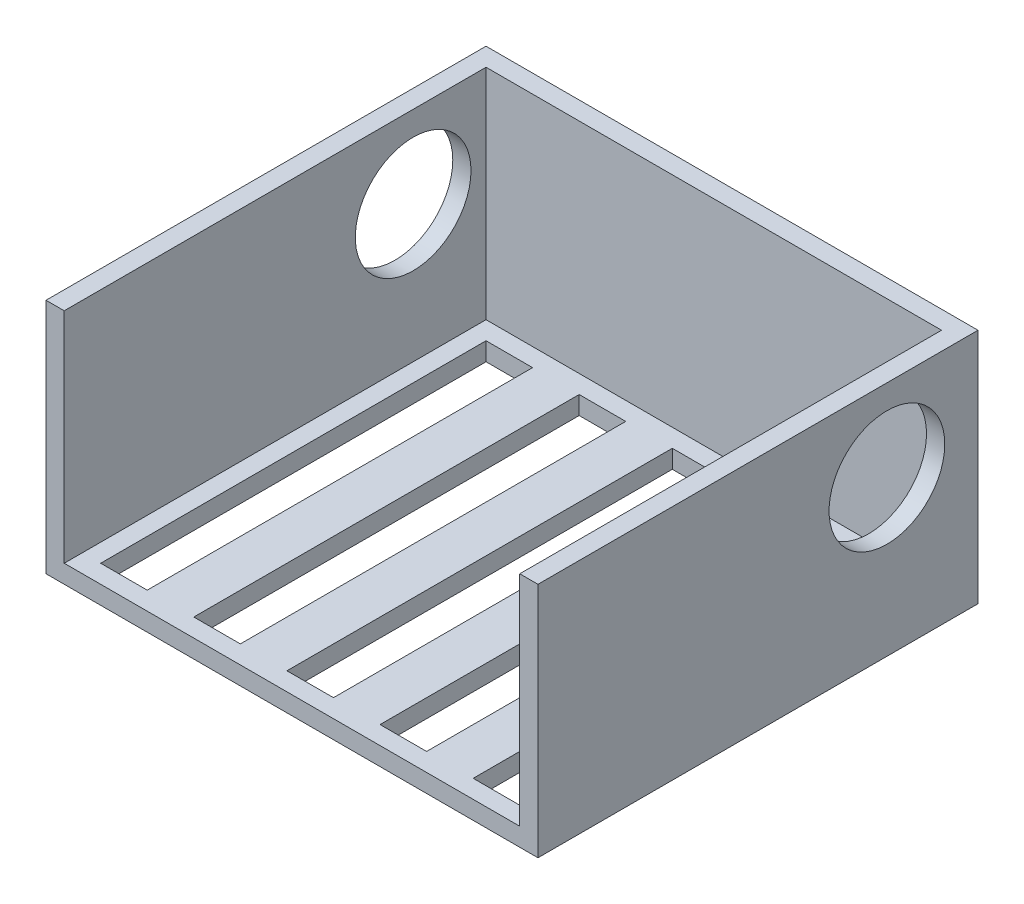
from build123d import *

# Parameters (mm, degrees)
CROQUIS1_W                 = 54
CROQUIS1_H                 = 50.3
CROQUIS1_W_2               = 50
CROQUIS1_H_2               = 46.3
SALIENTE_EXTRUIR1_DEPTH    = 24
CROQUIS2_W                 = 54
CROQUIS2_H                 = 50.3
SALIENTE_EXTRUIR2_DEPTH    = 2
CORTAR_EXTRUIR4_DEPTH      = 54
CORTAR_EXTRUIR5_REACH      = 75.646
CROQUIS7_W                 = 5.111111111
CROQUIS7_H                 = 42.3
CROQUIS7_W_2               = 5.111111112
CORTAR_EXTRUIR6_DEPTH      = 59.725548103
CORTAR_EXTRUIR6_DEPTH_BACK = 59.725548103
CROQUIS8_R                 = 6.35


with BuildPart() as part:
    # Croquis1 → Saliente-Extruir1 (new body)
    with BuildSketch(Plane(origin=(0, 0, 0), x_dir=(1, 0, 0), z_dir=(0, 1, 0))):
        with Locations((-25, -23.15)):
            Rectangle(CROQUIS1_W, CROQUIS1_H)
        with Locations((-25, -23.15)):
            Rectangle(CROQUIS1_W_2, CROQUIS1_H_2, mode=Mode.SUBTRACT)
    extrude(amount=SALIENTE_EXTRUIR1_DEPTH)

    # Croquis2 → Saliente-Extruir2 (add)
    with BuildSketch(Plane.XZ):
        with Locations((-25, 23.15)):
            Rectangle(CROQUIS2_W, CROQUIS2_H)
    extrude(amount=SALIENTE_EXTRUIR2_DEPTH)

    # Croquis6 → Cortar-Extruir4 (cut)
    with BuildSketch(Plane.ZY.offset(52)):
        Polygon((46.3, 24), (46.3, 0), (46.3, -2), (48.3, -2), (48.3, 24), align=None)
    extrude(amount=-CORTAR_EXTRUIR4_DEPTH, mode=Mode.SUBTRACT)

    # Croquis7 → Cortar-Extruir5 (cut, up to next)
    with BuildSketch(Plane(origin=(0, 0, 0), x_dir=(1, 0, 0), z_dir=(0, 1, 0)), mode=Mode.PRIVATE) as cortar_extruir5_sk1:
        with Locations((-45.444444445, -23.15)):
            Rectangle(CROQUIS7_W, CROQUIS7_H)
    cortar_extruir5_tool1 = extrude(cortar_extruir5_sk1.sketch, amount=-CORTAR_EXTRUIR5_REACH, mode=Mode.PRIVATE) & part.part
    # Croquis7 → Cortar-Extruir5 (cut, up to next)
    with BuildSketch(Plane(origin=(0, 0, 0), x_dir=(1, 0, 0), z_dir=(0, 1, 0)), mode=Mode.PRIVATE) as cortar_extruir5_sk2:
        with Locations((-35.222222223, -23.15)):
            Rectangle(CROQUIS7_W, CROQUIS7_H)
    cortar_extruir5_tool2 = extrude(cortar_extruir5_sk2.sketch, amount=-CORTAR_EXTRUIR5_REACH, mode=Mode.PRIVATE) & part.part
    # Croquis7 → Cortar-Extruir5 (cut, up to next)
    with BuildSketch(Plane(origin=(0, 0, 0), x_dir=(1, 0, 0), z_dir=(0, 1, 0)), mode=Mode.PRIVATE) as cortar_extruir5_sk3:
        with Locations((-14.777777778, -23.15)):
            Rectangle(CROQUIS7_W, CROQUIS7_H)
    cortar_extruir5_tool3 = extrude(cortar_extruir5_sk3.sketch, amount=-CORTAR_EXTRUIR5_REACH, mode=Mode.PRIVATE) & part.part
    # Croquis7 → Cortar-Extruir5 (cut, up to next)
    with BuildSketch(Plane(origin=(0, 0, 0), x_dir=(1, 0, 0), z_dir=(0, 1, 0)), mode=Mode.PRIVATE) as cortar_extruir5_sk4:
        with Locations((-4.555555555, -23.15)):
            Rectangle(CROQUIS7_W, CROQUIS7_H)
    cortar_extruir5_tool4 = extrude(cortar_extruir5_sk4.sketch, amount=-CORTAR_EXTRUIR5_REACH, mode=Mode.PRIVATE) & part.part
    # Croquis7 → Cortar-Extruir5 (cut, up to next)
    with BuildSketch(Plane(origin=(0, 0, 0), x_dir=(1, 0, 0), z_dir=(0, 1, 0)), mode=Mode.PRIVATE) as cortar_extruir5_sk5:
        with Locations((-25, -23.15)):
            Rectangle(CROQUIS7_W_2, CROQUIS7_H)
    cortar_extruir5_tool5 = extrude(cortar_extruir5_sk5.sketch, amount=-CORTAR_EXTRUIR5_REACH, mode=Mode.PRIVATE) & part.part
    add(cortar_extruir5_tool1.solids().sort_by_distance((-45.444444, 0, 23.15))[0], mode=Mode.SUBTRACT)
    add(cortar_extruir5_tool2.solids().sort_by_distance((-35.222222, 0, 23.15))[0], mode=Mode.SUBTRACT)
    add(cortar_extruir5_tool3.solids().sort_by_distance((-14.777778, 0, 23.15))[0], mode=Mode.SUBTRACT)
    add(cortar_extruir5_tool4.solids().sort_by_distance((-4.555556, 0, 23.15))[0], mode=Mode.SUBTRACT)
    add(cortar_extruir5_tool5.solids().sort_by_distance((-25, 0, 23.15))[0], mode=Mode.SUBTRACT)

    # Croquis8 → Cortar-Extruir6 (cut, two sides: drawn at the far end of the back side and taken through both)
    with BuildSketch(Plane(origin=(-25, 0, 0), x_dir=(0, 0, -1), z_dir=(1, 0, 0)).offset(-CORTAR_EXTRUIR6_DEPTH_BACK)):
        with Locations((-8, 15)):
            Circle(CROQUIS8_R)
    extrude(amount=CORTAR_EXTRUIR6_DEPTH + CORTAR_EXTRUIR6_DEPTH_BACK, mode=Mode.SUBTRACT)


solid = part.part
